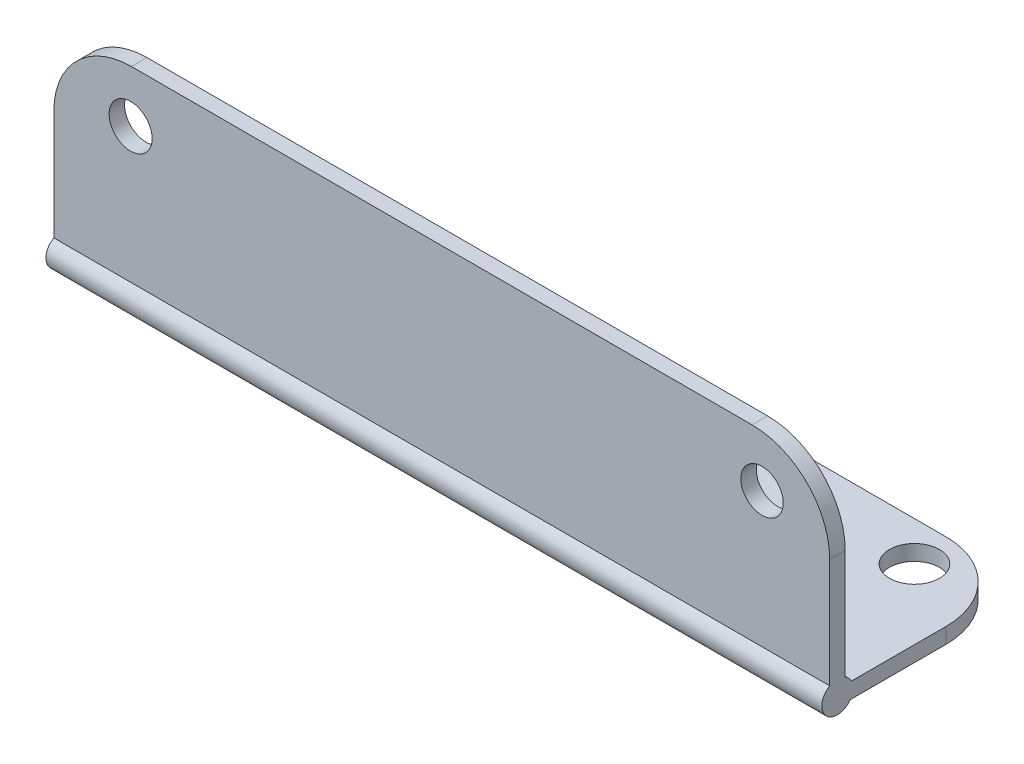
from build123d import *

# Parameters (mm, degrees)
BOSS_EXTRUDE1_DEPTH = 0.508
BOSS_EXTRUDE2_DEPTH = 0.508
SKETCH3_R           = 0.508
BOSS_EXTRUDE3_DEPTH = 25.4
SKETCH4_R           = 0.694806542
SKETCH4_R_2         = 0.705318585
CUT_EXTRUDE1_DEPTH  = 25.4
SKETCH5_R           = 0.773137268
SKETCH5_R_2         = 0.818403862
CUT_EXTRUDE2_DEPTH  = 25.4


with BuildPart() as part:
    # Sketch1 → Boss-Extrude1 (new body)
    with BuildSketch(Plane.XY):
        with BuildLine():
            Line((2.54, 0), (22.86, 0))
            ThreePointArc((22.86, 0), (24.656051224, -0.743948776), (25.4, -2.54))
            Line((25.4, -2.54), (25.4, -6.35))
            Line((25.4, -6.35), (0, -6.35))
            Line((0, -6.35), (0, -2.54))
            ThreePointArc((0, -2.54), (0.743948776, -0.743948776), (2.54, 0))
        make_face()
    extrude(amount=BOSS_EXTRUDE1_DEPTH)

    # Sketch2 → Boss-Extrude2 (add)
    with BuildSketch(Plane.XZ.offset(6.35)):
        with BuildLine():
            Line((25.4, 0.508), (0, 0.508))
            Line((0, 0.508), (0, -3.302))
            ThreePointArc((0, -3.302), (0.743948776, -5.098051224), (2.54, -5.842))
            Line((2.54, -5.842), (22.86, -5.842))
            ThreePointArc((22.86, -5.842), (24.656051224, -5.098051224), (25.4, -3.302))
            Line((25.4, -3.302), (25.4, 0.508))
        make_face()
    extrude(amount=BOSS_EXTRUDE2_DEPTH)

    # Sketch3 → Boss-Extrude3 (add)
    with BuildSketch(Plane(origin=(25.4, 0, 0), x_dir=(0, 0, -1), z_dir=(1, 0, 0))):
        with Locations((-0.257183831, -6.571194295)):
            Circle(SKETCH3_R)
    extrude(amount=-BOSS_EXTRUDE3_DEPTH)

    # Sketch4 → Cut-Extrude1 (cut)
    with BuildSketch(Plane(origin=(0, 0, 0), x_dir=(-1, 0, 0), z_dir=(0, 0, -1))):
        with Locations((-23.184832038, -1.708481591)):
            Circle(SKETCH4_R)
        with Locations((-2.513571979, -1.708481591)):
            Circle(SKETCH4_R_2)
    extrude(amount=-CUT_EXTRUDE1_DEPTH, mode=Mode.SUBTRACT)

    # Sketch5 → Cut-Extrude2 (cut)
    with BuildSketch(Plane(origin=(0, -6.35, 0), x_dir=(1, 0, 0), z_dir=(0, 1, 0))):
        with Locations(Location((2.571816613, 3.784683683, 0), (0, 0, 270))):
            Circle(SKETCH5_R)
        with Locations(Location((23.109034226, 4.557820951, 0), (0, 0, 270))):
            Circle(SKETCH5_R_2)
    extrude(amount=-CUT_EXTRUDE2_DEPTH, mode=Mode.SUBTRACT)


solid = part.part
